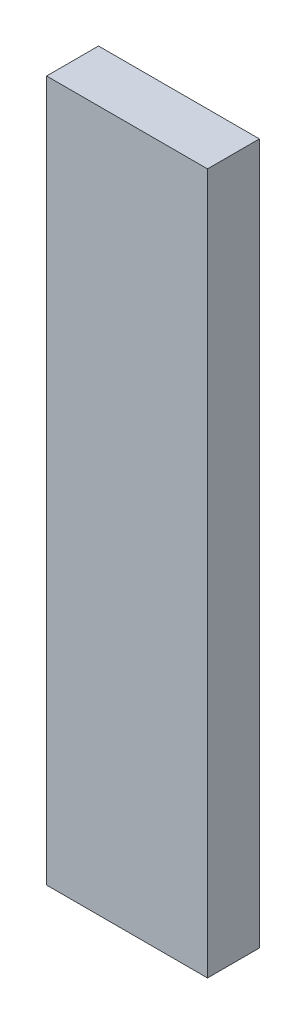
from build123d import *

# Parameters (mm, degrees)
SKETCH1_W           = 62
SKETCH1_H           = 20
BOSS_EXTRUDE1_DEPTH = 270
SHELL1_T            = -1.2


with BuildPart() as part:
    # Sketch1 → Boss-Extrude1 (new body)
    with BuildSketch(Plane(origin=(0, 0, 0), x_dir=(1, 0, 0), z_dir=(0, 1, 0))):
        with Locations((-2.066666667, -22.623809524)):
            Rectangle(SKETCH1_W, SKETCH1_H)
    extrude(amount=BOSS_EXTRUDE1_DEPTH)

    # Shell1
    shell1_openings = [part.faces().sort_by_distance(p)[0] for p in [
        (-2.066666667, 0, 22.623809524),
    ]]
    offset(amount=SHELL1_T, openings=shell1_openings, kind=Kind.INTERSECTION)


solid = part.part
